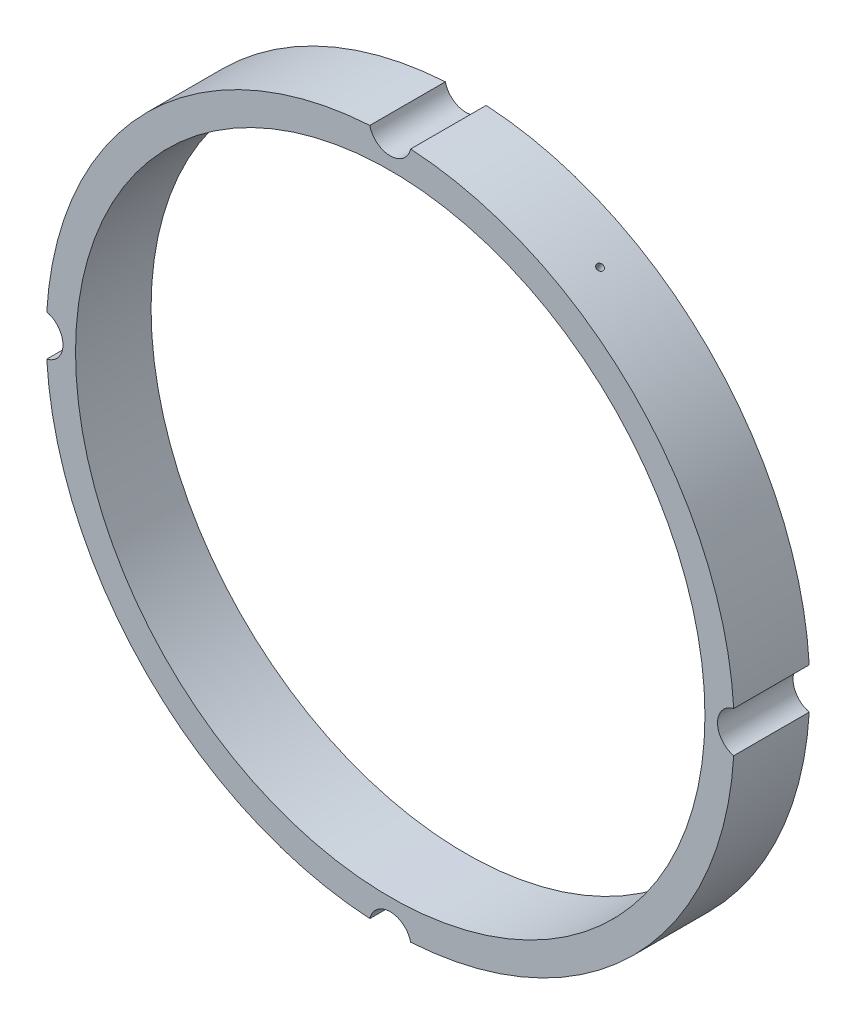
from build123d import *

# Parameters (mm, degrees)
SKETCH1_R                 = 82
SKETCH1_R_2               = 75
BOSS_EXTRUDE1_DEPTH       = 18
SKETCH2_R                 = 5
CUT_EXTRUDE1_DEPTH        = 118.354164817
CIRPATTERN1_COUNT         = 4
M2X0_4_TAPPED_HOLE1_D     = 1.6
M2X0_4_TAPPED_HOLE1_DEPTH = 10
M2X0_4_TAPPED_HOLE1_TIP   = 0.480688495


with BuildPart() as part:
    # Sketch1 → Boss-Extrude1 (new body)
    with BuildSketch(Plane.XY):
        Circle(SKETCH1_R)
        Circle(SKETCH1_R_2, mode=Mode.SUBTRACT)
    extrude(amount=BOSS_EXTRUDE1_DEPTH)

    # Sketch2 → Cut-Extrude1 (cut, through all)
    with BuildSketch(Plane.XY.offset(18)):
        with Locations((0, 83)):
            Circle(SKETCH2_R)
    cut_extrude1 = extrude(amount=-CUT_EXTRUDE1_DEPTH, mode=Mode.SUBTRACT)

    # CirPattern1: Cut-Extrude1 ×4 about axis
    cirpattern1_axis = Axis((0, 0, 0), (0, 0, 1))
    for i in range(1, CIRPATTERN1_COUNT):
        add(cut_extrude1.rotate(cirpattern1_axis, i * 360 / CIRPATTERN1_COUNT), mode=Mode.SUBTRACT)

    # M2x0.4 Tapped Hole1
    with Locations(Plane(origin=(41, 71.01408311, 9), x_dir=(0.866025403784, -0.5, 0), z_dir=(0.5, 0.866025403784, 0))):
        with Locations((0, 0)):
            Hole(M2X0_4_TAPPED_HOLE1_D / 2, depth=M2X0_4_TAPPED_HOLE1_DEPTH)
            with Locations((0, 0, -(M2X0_4_TAPPED_HOLE1_DEPTH + M2X0_4_TAPPED_HOLE1_TIP / 2))):  # 118° drill point
                Cone(0, M2X0_4_TAPPED_HOLE1_D / 2, M2X0_4_TAPPED_HOLE1_TIP, mode=Mode.SUBTRACT)


solid = part.part
